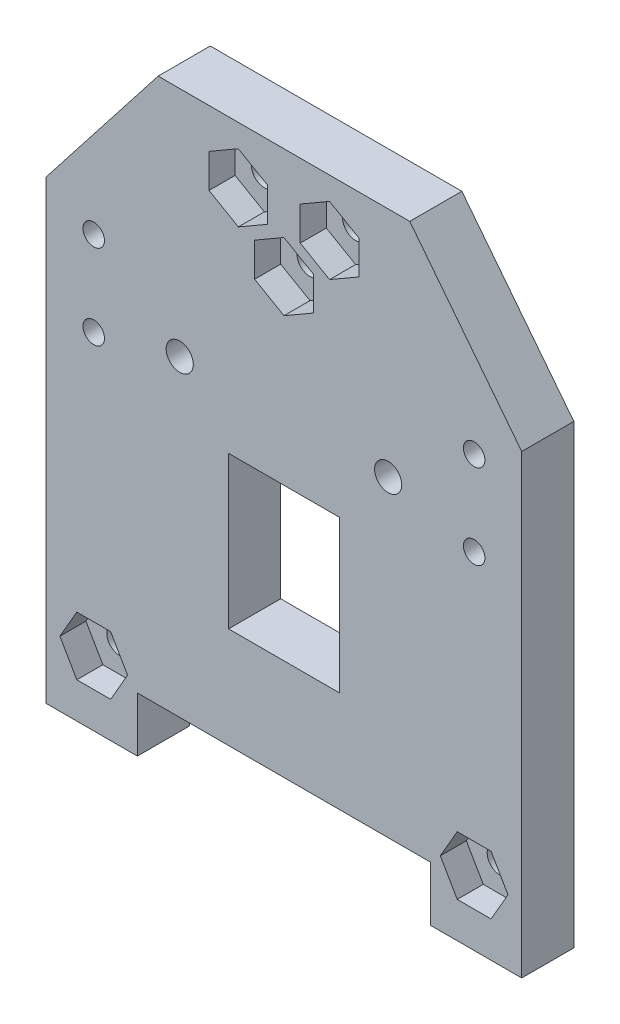
from build123d import *

# Parameters (mm, degrees)
ESBO_O1_R                = 2
ESBO_O1_R_2              = 2.086716092
ESBO_O1_R_3              = 2.086717953
RESSALTO_EXTRUS_O1_DEPTH = 8
ESBO_O4_R                = 1.65
CORTE_EXTRUS_O1_DEPTH    = 100.298791533
CORTE_EXTRUS_O2_DEPTH    = 4


with BuildPart() as part:
    # Esboço1 → Ressalto-extrusão1 (new body)
    with BuildSketch(Plane.XY):
        Polygon((19.311716217, 92), (-19.311716217, 92), (-36.5, 70), (-36.5, 0), (-22.499999998, 0), (-22.499999998, 8.400000004), (22.499999998, 8.400000004), (22.499999998, 0), (36.5, 0), (36.5, 70), align=None)
        with Locations((0, 75)):
            Circle(ESBO_O1_R, mode=Mode.SUBTRACT)
        with Locations((-7, 83.3)):
            Circle(ESBO_O1_R, mode=Mode.SUBTRACT)
        with Locations((7, 83.3)):
            Circle(ESBO_O1_R, mode=Mode.SUBTRACT)
        with Locations((-29.2, 10)):
            Circle(ESBO_O1_R, mode=Mode.SUBTRACT)
        with Locations((29.2, 10)):
            Circle(ESBO_O1_R, mode=Mode.SUBTRACT)
        with Locations((-16, 56.354540575)):
            Circle(ESBO_O1_R_2, mode=Mode.SUBTRACT)
        with Locations((16, 56.354540575)):
            Circle(ESBO_O1_R_3, mode=Mode.SUBTRACT)
        Polygon((0, 47.257129716), (8.5, 47.257129716), (8.5, 23.917682695), (0, 23.917682695), (-8.5, 23.917682695), (-8.5, 47.257129716), align=None, mode=Mode.SUBTRACT)
    extrude(amount=RESSALTO_EXTRUS_O1_DEPTH)

    # Esboço4 → Corte-extrusão1 (cut, through all)
    with BuildSketch(Plane.XY.offset(8)):
        with Locations((-29.2, 66)):
            Circle(ESBO_O4_R)
        with Locations((-29.2, 53)):
            Circle(ESBO_O4_R)
        with Locations((29.2, 53)):
            Circle(ESBO_O4_R)
        with Locations((29.2, 66)):
            Circle(ESBO_O4_R)
    extrude(amount=-CORTE_EXTRUS_O1_DEPTH, mode=Mode.SUBTRACT)

    # Esboço5 → Corte-extrusão2 (cut)
    with BuildSketch(Plane.XY.offset(8)):
        Polygon((4.5, 72.401923789), (4.5, 77.598076211), (0, 80.196152423), (-4.5, 77.598076211), (-4.5, 72.401923789), (0, 69.803847577), align=None)
        Polygon((-26.601923789, 14.5), (-31.798076211, 14.5), (-34.396152423, 10), (-31.798076211, 5.5), (-26.601923789, 5.5), (-24.003847577, 10), align=None)
        Polygon((-11.5, 80.701923789), (-7, 78.103847577), (-2.5, 80.701923789), (-2.5, 85.898076211), (-7, 88.496152423), (-11.5, 85.898076211), align=None)
        Polygon((11.5, 80.701923789), (11.5, 85.898076211), (7, 88.496152423), (2.5, 85.898076211), (2.5, 80.701923789), (7, 78.103847577), align=None)
        Polygon((31.798076211, 5.5), (34.396152423, 10), (31.798076211, 14.5), (26.601923789, 14.5), (24.003847577, 10), (26.601923789, 5.5), align=None)
    extrude(amount=-CORTE_EXTRUS_O2_DEPTH, mode=Mode.SUBTRACT)


solid = part.part
